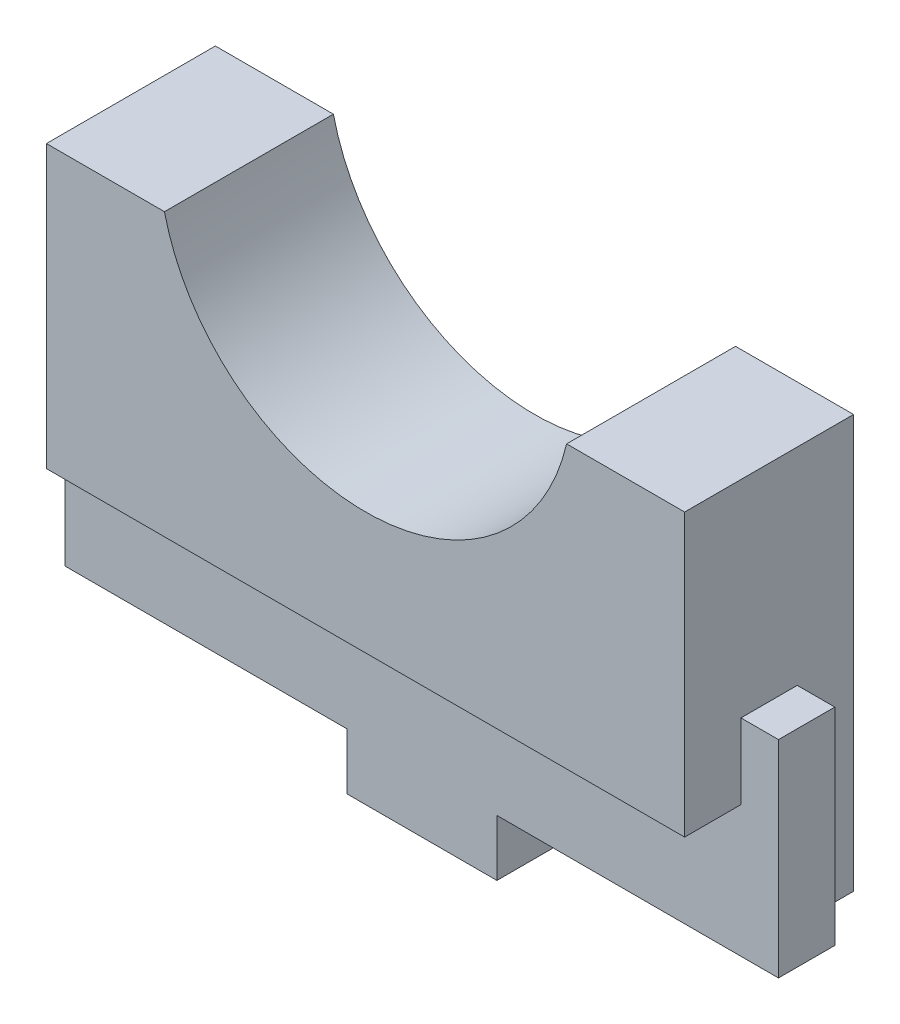
from build123d import *

# Parameters (mm, degrees)
BOSS_EXTRUDE1_DEPTH = 9
SKETCH2_W           = 8
SKETCH2_H           = 9
BOSS_EXTRUDE2_DEPTH = 3
SKETCH3_W           = 3
SKETCH3_H           = 11
BOSS_EXTRUDE3_DEPTH = 2
SKETCH4_W           = 3
SKETCH4_H           = 11
BOSS_EXTRUDE4_DEPTH = 2
SKETCH6_W           = 34
SKETCH6_H           = 10
CUT_EXTRUDE2_DEPTH  = 3


with BuildPart() as part:
    # Sketch1 → Boss-Extrude1 (new body)
    with BuildSketch(Plane.XY):
        with BuildLine():
            Line((-10.712142643, -2.5), (-17, -2.5))
            Line((-17, -2.5), (-17, -24.5))
            Line((-17, -24.5), (17, -24.5))
            Line((17, -24.5), (17, -2.5))
            Line((17, -2.5), (10.712142643, -2.5))
            ThreePointArc((10.712142643, -2.5), (0, -11), (-10.712142643, -2.5))
        make_face()
    extrude(amount=BOSS_EXTRUDE1_DEPTH)

    # Sketch2 → Boss-Extrude2 (add)
    with BuildSketch(Plane.XZ.offset(24.5)):
        with Locations((0, 4.5)):
            Rectangle(SKETCH2_W, SKETCH2_H)
    extrude(amount=BOSS_EXTRUDE2_DEPTH)

    # Sketch3 → Boss-Extrude3 (add)
    with BuildSketch(Plane.ZY.offset(17)):
        with Locations((4.5, -19)):
            Rectangle(SKETCH3_W, SKETCH3_H)
    extrude(amount=BOSS_EXTRUDE3_DEPTH)

    # Sketch4 → Boss-Extrude4 (add)
    with BuildSketch(Plane(origin=(17, 0, 0), x_dir=(0, 0, -1), z_dir=(1, 0, 0))):
        with Locations((-4.5, -19)):
            Rectangle(SKETCH4_W, SKETCH4_H)
    extrude(amount=BOSS_EXTRUDE4_DEPTH)

    # Sketch6 → Cut-Extrude2 (cut)
    with BuildSketch(Plane.XY.offset(9)):
        with Locations((0, -22.5)):
            Rectangle(SKETCH6_W, SKETCH6_H)
    extrude(amount=-CUT_EXTRUDE2_DEPTH, mode=Mode.SUBTRACT)


solid = part.part
